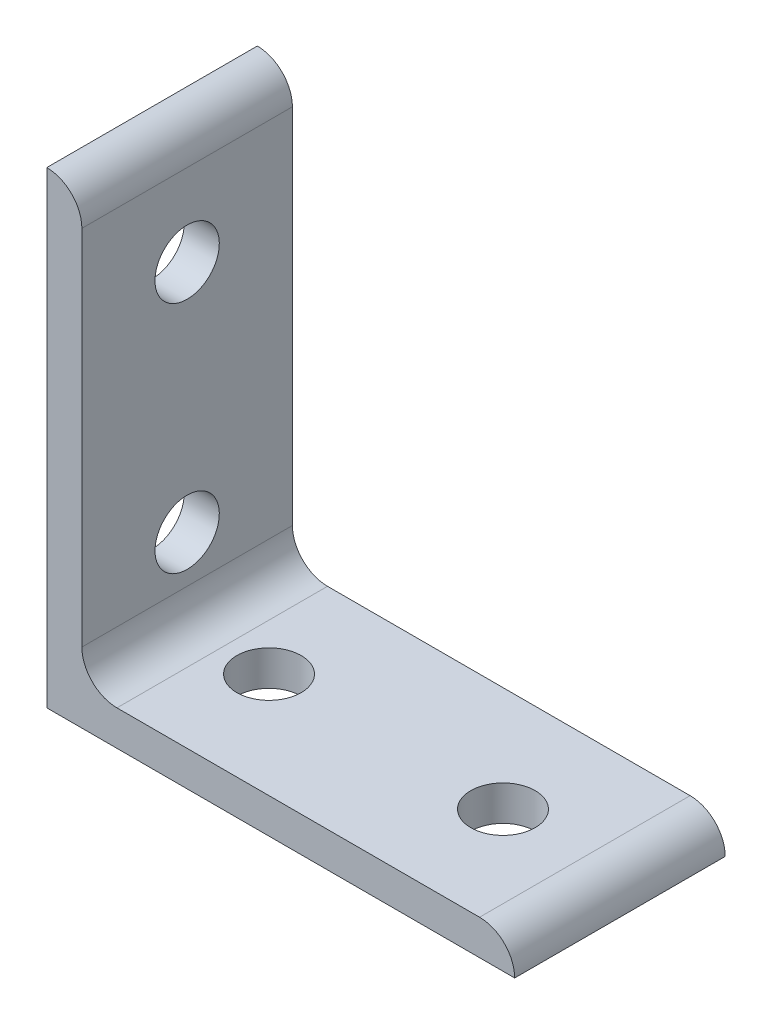
from build123d import *

# Parameters (mm, degrees)
BOSS_EXTRUDE1_DEPTH = 9
SKETCH2_R           = 2.75
CUT_EXTRUDE1_DEPTH  = 58.280013966
SKETCH3_R           = 2.75
CUT_EXTRUDE2_DEPTH  = 58.280013966


with BuildPart() as part:
    # Sketch1 → Boss-Extrude1 (new, symmetric)
    with BuildSketch(Plane.XY):
        with BuildLine():
            Line((0, 0), (0, 40))
            ThreePointArc((0, 40), (2.121320344, 39.121320344), (3, 37))
            Line((3, 37), (3, 6))
            ThreePointArc((3, 6), (3.878679656, 3.878679656), (6, 3))
            Line((6, 3), (37, 3))
            ThreePointArc((37, 3), (39.121320344, 2.121320344), (40, 0))
            Line((40, 0), (0, 0))
        make_face()
    extrude(amount=BOSS_EXTRUDE1_DEPTH, both=True)

    # Sketch2 → Cut-Extrude1 (cut, through all)
    with BuildSketch(Plane(origin=(0, 0, 0), x_dir=(1, 0, 0), z_dir=(0, 1, 0))):
        with Locations((10, 0)):
            Circle(SKETCH2_R)
        with Locations((30, 0)):
            Circle(SKETCH2_R)
    extrude(amount=CUT_EXTRUDE1_DEPTH, mode=Mode.SUBTRACT)

    # Sketch3 → Cut-Extrude2 (cut, through all)
    with BuildSketch(Plane(origin=(0, 0, 0), x_dir=(0, 0, -1), z_dir=(1, 0, 0))):
        with Locations(Location((0, 10, 0), (0, 0, 270))):
            Circle(SKETCH3_R)
        with Locations(Location((0, 30, 0), (0, 0, 270))):
            Circle(SKETCH3_R)
    extrude(amount=CUT_EXTRUDE2_DEPTH, mode=Mode.SUBTRACT)


solid = part.part
